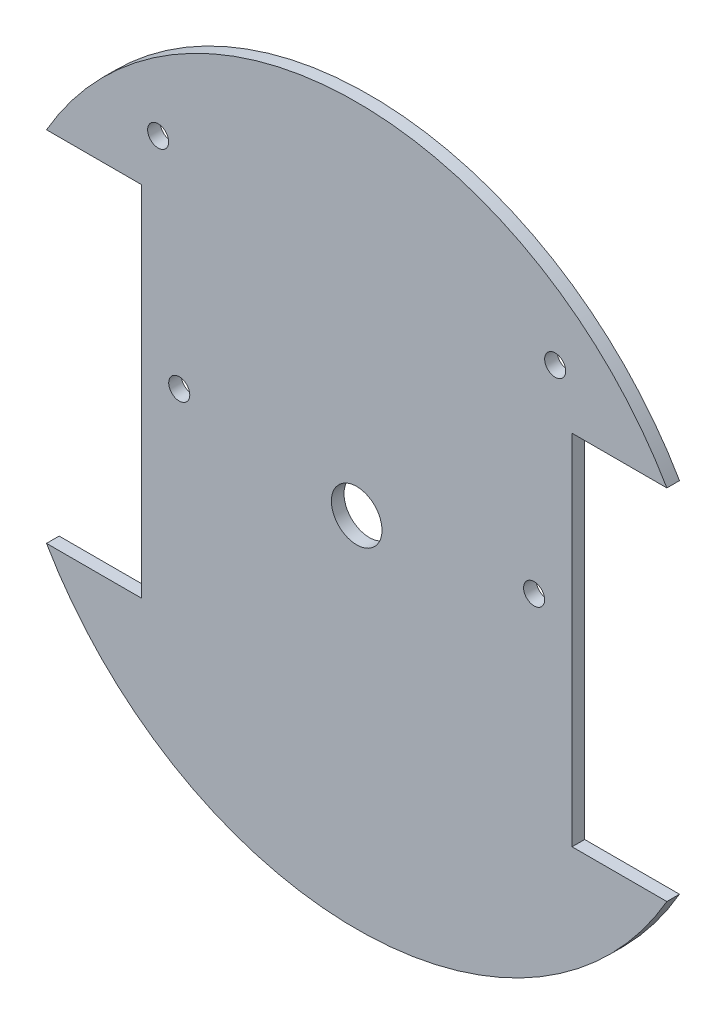
from build123d import *

# Parameters (mm, degrees)
ESQUISSE1_R              = 85
BOSS_EXTRU_1_DEPTH       = 3
ESQUISSE2_W              = 32.5
ESQUISSE2_H              = 85
ENL_V_MAT_EXTRU_6_DEPTH  = 3
ESQUISSE53_R             = 2.5
ENL_V_MAT_EXTRU_21_DEPTH = 10
ESQUISSE54_R             = 2.5
ENL_V_MAT_EXTRU_22_DEPTH = 10
ESQUISSE55_R             = 6
ENL_V_MAT_EXTRU_23_DEPTH = 10


with BuildPart() as part:
    # Esquisse1 → Boss.-Extru.1 (new body)
    with BuildSketch(Plane.XY):
        with Locations((-147.95974357, 62.548931244)):
            Circle(ESQUISSE1_R)
    extrude(amount=BOSS_EXTRU_1_DEPTH)

    # Esquisse2 → Enlèv. mat.-Extru.6 (cut)
    with BuildSketch(Plane.XY):
        with BuildLine():
            Line((-199.071902892, 105.048931244), (-221.571902892, 105.048931244))
            ThreePointArc((-221.571902892, 105.048931244), (-227.739869981, 91.876928617), (-231.571902892, 77.846212492))
            Line((-231.571902892, 77.846212492), (-231.571902892, 47.251649997))
            ThreePointArc((-231.571902892, 47.251649997), (-227.739869981, 33.220933871), (-221.571902892, 20.048931244))
            Line((-221.571902892, 20.048931244), (-199.071902892, 20.048931244))
            Line((-199.071902892, 20.048931244), (-199.071902892, 105.048931244))
        make_face()
        with Locations((-80.597584249, 62.548931244)):
            Rectangle(ESQUISSE2_W, ESQUISSE2_H)
    extrude(amount=ENL_V_MAT_EXTRU_6_DEPTH, mode=Mode.SUBTRACT)


with BuildPart() as enl_v_mat_extru_6_piece_1:
    # of the separate pieces the step leaves, piece 1, a body of its own (enl_v_mat_extru_6_pieces)
    add(part.part.solids().sort_by_distance((-74.347584249, 105.048931244, 0))[0])

    # Esquisse53 → Enlèv. mat.-Extru.21 (cut)
    with BuildSketch(Plane(origin=(0, 0, 0), x_dir=(-1, 0, 0), z_dir=(0, 0, -1))):
        with Locations((190.071902892, 67.548931244)):
            Circle(ESQUISSE53_R)
        with Locations((105.847584249, 67.548931244)):
            Circle(ESQUISSE53_R)
    extrude(amount=-ENL_V_MAT_EXTRU_21_DEPTH, mode=Mode.SUBTRACT)

    # Esquisse54 → Enlèv. mat.-Extru.22 (cut)
    with BuildSketch(Plane(origin=(0, 0, 0), x_dir=(-1, 0, 0), z_dir=(0, 0, -1))):
        with Locations((195.071902892, 117.048931244)):
            Circle(ESQUISSE54_R)
        with Locations(Location((100.847584249, 117.048931244, 0), (0, 0, 180))):
            Circle(ESQUISSE54_R)
    extrude(amount=-ENL_V_MAT_EXTRU_22_DEPTH, mode=Mode.SUBTRACT)

    # Esquisse55 → Enlèv. mat.-Extru.23 (cut)
    with BuildSketch(Plane(origin=(0, 0, 0), x_dir=(-1, 0, 0), z_dir=(0, 0, -1))):
        with Locations((147.95974357, 62.548931244)):
            Circle(ESQUISSE55_R)
    extrude(amount=-ENL_V_MAT_EXTRU_23_DEPTH, mode=Mode.SUBTRACT)


with BuildPart() as enl_v_mat_extru_6_piece_2:
    # of the separate pieces the step leaves, piece 2, a body of its own (enl_v_mat_extru_6_pieces)
    add(part.part.solids().sort_by_distance((-64.347584249, 47.251649997, 0))[0])


with BuildPart() as enl_v_mat_extru_6_piece_3:
    # of the separate pieces the step leaves, piece 3, a body of its own (enl_v_mat_extru_6_pieces)
    add(part.part.solids().sort_by_distance((-231.571902892, 77.846212492, 0))[0])


solid = enl_v_mat_extru_6_piece_1.part
